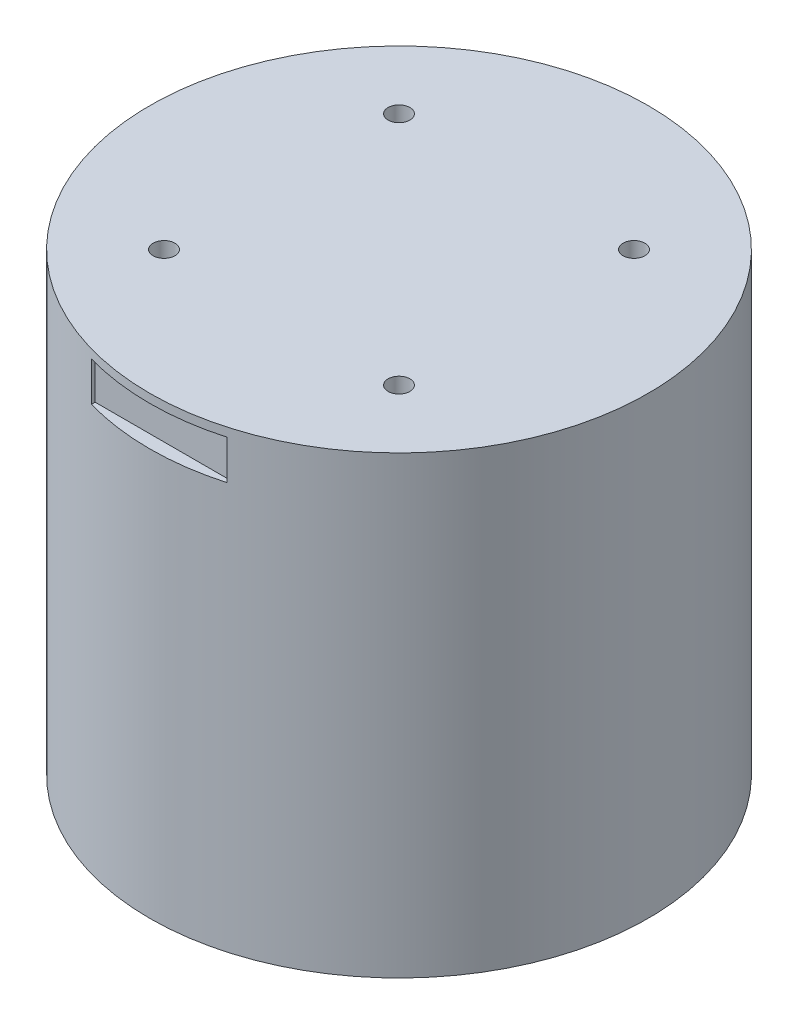
from build123d import *

# Parameters (mm, degrees)
SKETCH_1_R          = 28.5
EXTRUDE_1_DEPTH     = 52
SKETCH_2_R          = 17.5
EXTRUDE_2_DEPTH     = 1
SKETCH_3_R          = 1.25
SKETCH_3_R_2        = 4.75
CUT_EXTRUDE_1_DEPTH = 3.5
MOVE_FACE_1_BY      = 3.5
MOVE_FACE_1_2_BY    = 3.5
MOVE_FACE_1_3_BY    = 3.5
MOVE_FACE_1_4_BY    = 3.5
MOVE_FACE_1_5_BY    = 3.5
MOVE_FACE_1_6_BY    = 3.5
SKETCH_4_R          = 1.25
CUT_EXTRUDE_2_DEPTH = 5
SKETCH_5_W          = 15.5
SKETCH_5_H          = 4.5
CUT_EXTRUDE_3_DEPTH = 1.5
SKETCH_6_R          = 1.25
CUT_EXTRUDE_4_DEPTH = 5


with BuildPart() as part:
    # 草图1 → 凸台-拉伸1 (new body)
    with BuildSketch(Plane(origin=(0, 0, 0), x_dir=(1, 0, 0), z_dir=(0, 1, 0))):
        Circle(SKETCH_1_R)
    extrude(amount=EXTRUDE_1_DEPTH)

    # 草图2 → 凸台-拉伸2 (add)
    with BuildSketch(Plane.XZ):
        Circle(SKETCH_2_R)
    extrude(amount=EXTRUDE_2_DEPTH)

    # 草图3 → 切除-拉伸1 (cut)
    with BuildSketch(Plane.XZ.offset(1)):
        with Locations((0, 13.5)):
            Circle(SKETCH_3_R)
        with Locations((11.691342951, 6.75)):
            Circle(SKETCH_3_R)
        with Locations((11.691342951, -6.75)):
            Circle(SKETCH_3_R)
        with Locations((0, -13.5)):
            Circle(SKETCH_3_R)
        with Locations((-11.691342951, -6.75)):
            Circle(SKETCH_3_R)
        with Locations((-11.691342951, 6.75)):
            Circle(SKETCH_3_R)
        Circle(SKETCH_3_R_2)
    extrude(amount=-CUT_EXTRUDE_1_DEPTH, mode=Mode.SUBTRACT)

    # Move Face 1: a face moved inward by 3.5
    extrude(part.faces().sort_by_distance((11.691342951, 2.5, -6.75))[0], amount=MOVE_FACE_1_BY, dir=(0, 1, 0), mode=Mode.SUBTRACT)

    # Move Face 1 2: a face moved inward by 3.5
    extrude(part.faces().sort_by_distance((0, 2.5, -13.5))[0], amount=MOVE_FACE_1_2_BY, dir=(0, 1, 0), mode=Mode.SUBTRACT)

    # Move Face 1 3: a face moved inward by 3.5
    extrude(part.faces().sort_by_distance((-11.691342951, 2.5, -6.75))[0], amount=MOVE_FACE_1_3_BY, dir=(0, 1, 0), mode=Mode.SUBTRACT)

    # Move Face 1 4: a face moved inward by 3.5
    extrude(part.faces().sort_by_distance((-11.691342951, 2.5, 6.75))[0], amount=MOVE_FACE_1_4_BY, dir=(0, 1, 0), mode=Mode.SUBTRACT)

    # Move Face 1 5: a face moved inward by 3.5
    extrude(part.faces().sort_by_distance((0, 2.5, 13.5))[0], amount=MOVE_FACE_1_5_BY, dir=(0, 1, 0), mode=Mode.SUBTRACT)

    # Move Face 1 6: a face moved inward by 3.5
    extrude(part.faces().sort_by_distance((11.691342951, 2.5, 6.75))[0], amount=MOVE_FACE_1_6_BY, dir=(0, 1, 0), mode=Mode.SUBTRACT)

    # 草图4 → 切除-拉伸2 (cut)
    with BuildSketch(Plane.XZ):
        with Locations((0, 25)):
            Circle(SKETCH_4_R)
        with Locations((21.650635095, 12.5)):
            Circle(SKETCH_4_R)
        with Locations((21.650635095, -12.5)):
            Circle(SKETCH_4_R)
        with Locations((0, -25)):
            Circle(SKETCH_4_R)
        with Locations((-21.650635095, -12.5)):
            Circle(SKETCH_4_R)
        with Locations((-21.650635095, 12.5)):
            Circle(SKETCH_4_R)
    extrude(amount=-CUT_EXTRUDE_2_DEPTH, mode=Mode.SUBTRACT)

    # 草图5 → 切除-拉伸3 (cut)
    with BuildSketch(Plane.XY.offset(28.5)):
        with Locations((0, 48.75)):
            Rectangle(SKETCH_5_W, SKETCH_5_H)
    extrude(amount=-CUT_EXTRUDE_3_DEPTH, mode=Mode.SUBTRACT)

    # 草图6 → 切除-拉伸4 (cut)
    with BuildSketch(Plane(origin=(0, 52, 0), x_dir=(1, 0, 0), z_dir=(0, 1, 0))):
        with Locations((13.435028843, 13.435028843)):
            Circle(SKETCH_6_R)
        with Locations((13.435028843, -13.435028843)):
            Circle(SKETCH_6_R)
        with Locations((-13.435028843, -13.435028843)):
            Circle(SKETCH_6_R)
        with Locations((-13.435028843, 13.435028843)):
            Circle(SKETCH_6_R)
    extrude(amount=-CUT_EXTRUDE_4_DEPTH, mode=Mode.SUBTRACT)


solid = part.part
